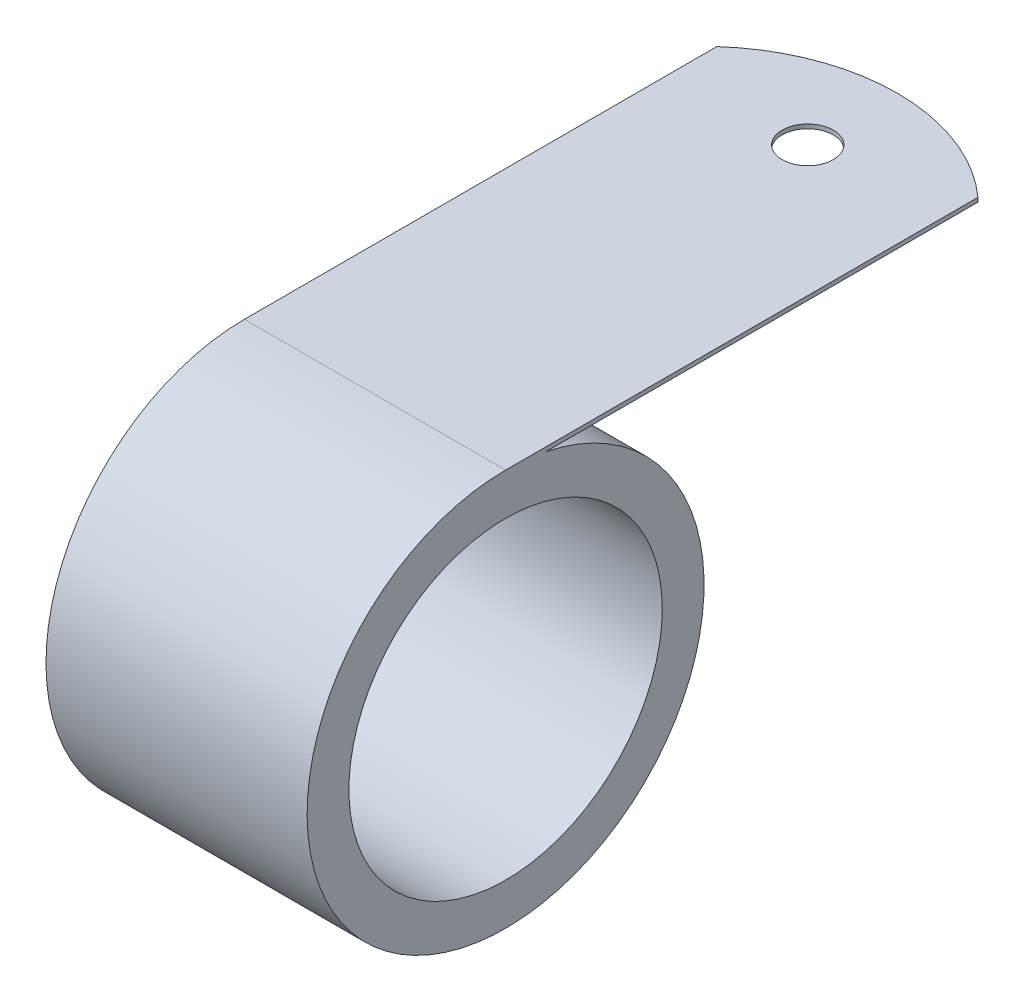
from build123d import *

# Parameters (mm, degrees)
SKETCH1_R           = 15.24
BOSS_EXTRUDE1_DEPTH = 12.7
ONEHOLE_START       = -0.4064
SKETCH2_R           = 2.4892
ONEHOLE_DEPTH       = 0.4064


with BuildPart() as part:
    # Sketch1 → Boss-Extrude1 (new, symmetric)
    with BuildSketch(Plane(origin=(0, 0, 0), x_dir=(0, 0, -1), z_dir=(1, 0, 0))):
        with BuildLine():
            Line((0, 19.304), (50.8, 19.304))
            Line((50.8, 19.304), (50.8, 18.8976))
            Line((50.8, 18.8976), (3.940194188, 18.8976))
            ThreePointArc((3.940194188, 18.8976), (-1.980548611, -19.202131215), (0, 19.304))
        make_face()
        Circle(SKETCH1_R, mode=Mode.SUBTRACT)
    extrude(amount=BOSS_EXTRUDE1_DEPTH, both=True)

    # Sketch2 → OneHole (cut)
    with BuildSketch(Plane(origin=(0, 19.304, 0), x_dir=(1, 0, 0), z_dir=(0, 1, 0)).offset(ONEHOLE_START)):
        with Locations(Location((0, 42.0878, 0), (0, 0, 270))):
            Circle(SKETCH2_R)
        with BuildLine():
            Line((-12.7, 45.949031657), (-12.7, 51.435))
            Line((-12.7, 51.435), (12.7, 51.435))
            Line((12.7, 51.435), (12.7, 45.949031657))
            ThreePointArc((12.7, 45.949031657), (0, 50.8), (-12.7, 45.949031657))
        make_face()
    extrude(amount=ONEHOLE_DEPTH, mode=Mode.SUBTRACT)


solid = part.part
